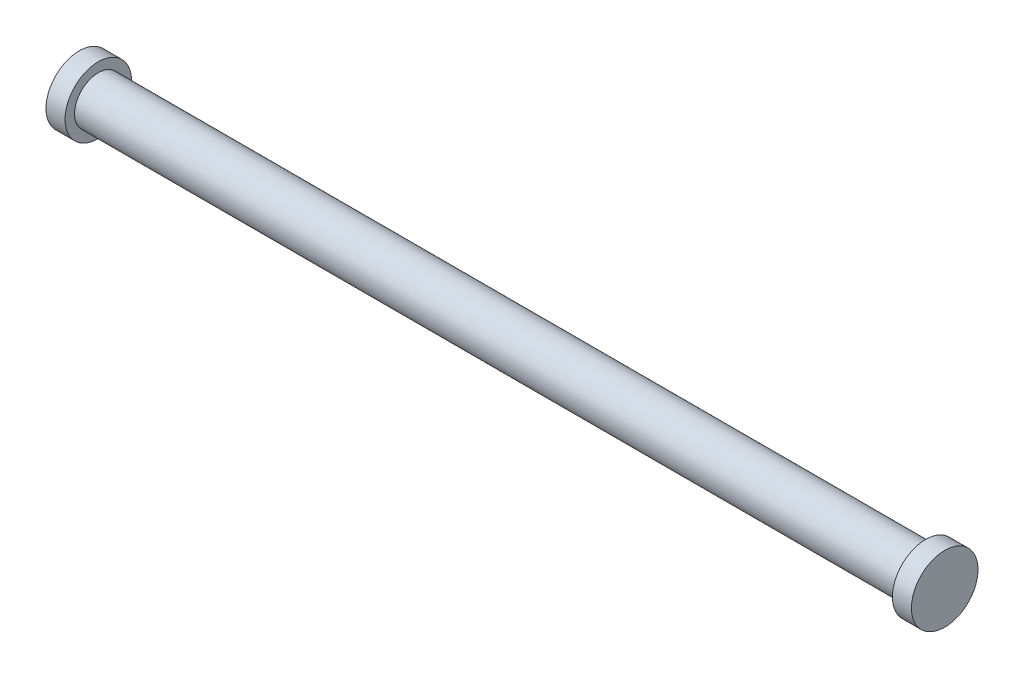
from build123d import *

# Parameters (mm, degrees)
SKETCH1_R           = 12.5
BOSS_EXTRUDE1_DEPTH = 434.9
SKETCH3_R           = 17.5
BOSS_EXTRUDE3_DEPTH = 10
BOSS_EXTRUDE4_START = 10
SKETCH4_R           = 17.5
BOSS_EXTRUDE4_DEPTH = 10


with BuildPart() as part:
    # Sketch1 → Boss-Extrude1 (new body)
    with BuildSketch(Plane(origin=(0, 0, 0), x_dir=(0, 0, -1), z_dir=(1, 0, 0))):
        Circle(SKETCH1_R)
    extrude(amount=-BOSS_EXTRUDE1_DEPTH)

    # Sketch3 → Boss-Extrude3 (add)
    with BuildSketch(Plane(origin=(0, 0, 0), x_dir=(0, 0, -1), z_dir=(1, 0, 0))):
        Circle(SKETCH3_R)
    extrude(amount=BOSS_EXTRUDE3_DEPTH)

    # Sketch4 → Boss-Extrude4 (add)
    with BuildSketch(Plane.ZY.offset(434.9).offset(BOSS_EXTRUDE4_START)):
        with Locations(Location((0, 0, 0), (0, 0, 180))):
            Circle(SKETCH4_R)
    extrude(amount=-BOSS_EXTRUDE4_DEPTH)


solid = part.part
